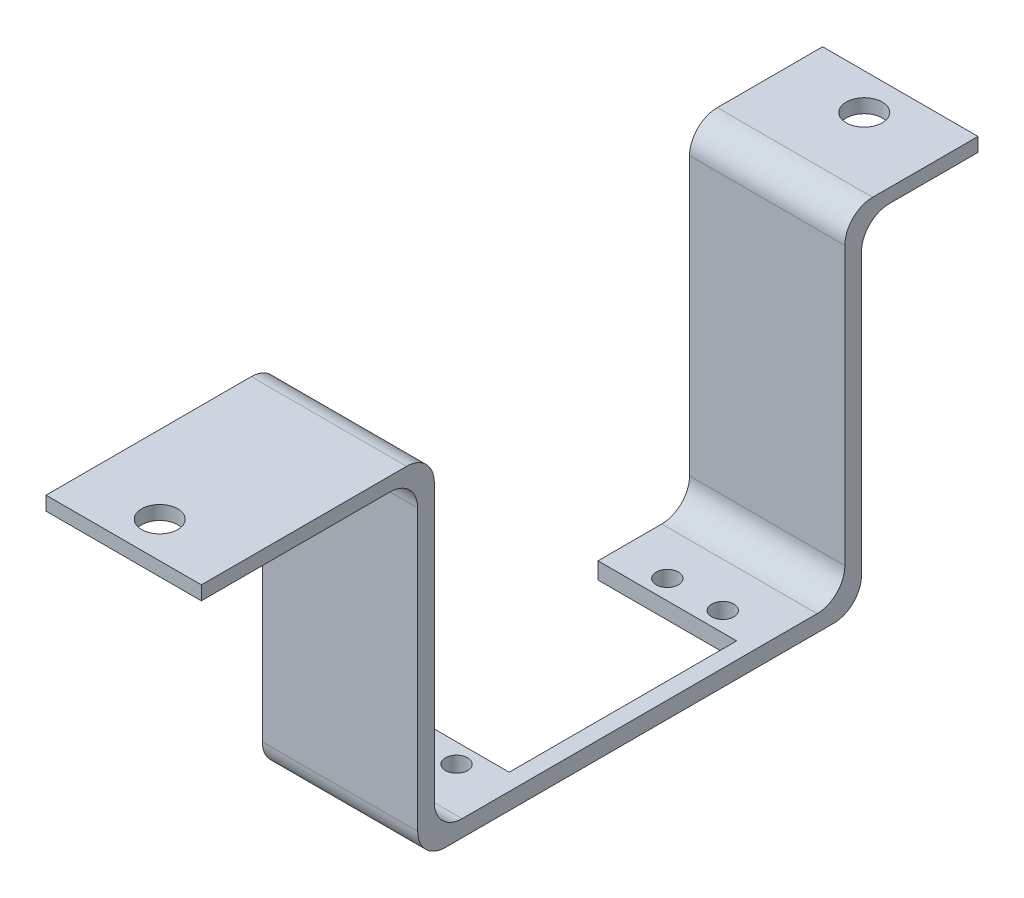
from build123d import *

# Parameters (mm, degrees)
SKETCH1_W               = 32
SKETCH1_H               = 80
BOSS_EXTRUDE1_DEPTH     = 3
SKETCH4_W               = 32
SKETCH4_H               = 80
SKETCH4_W_2             = 27
SKETCH4_H_2             = 74
BOSS_EXTRUDE2_DEPTH     = 57.5
SKETCH5_W               = 32
SKETCH5_H               = 140
BOSS_EXTRUDE3_DEPTH     = 2.5
CUT_EXTRUDE1_DEPTH      = 50.8
CUT_EXTRUDE1_DEPTH_BACK = 94.573500522
SKETCH2_W               = 22
SKETCH2_H               = 41
SKETCH6_R               = 3.25
SKETCH6_W               = 22
SKETCH6_H               = 74
CUT_EXTRUDE2_DEPTH      = 25.4
CUT_EXTRUDE3_DEPTH      = 100.463561167
CUT_EXTRUDE3_DEPTH_BACK = 100.463561167
SKETCH8_W               = 74
SKETCH8_H               = 60
SKETCH7_R               = 2
CUT_EXTRUDE4_DEPTH      = 94.573500522
SKETCH10_W              = 2
SKETCH10_H              = 140
CUT_EXTRUDE5_DEPTH      = 96.524865873
FILLET1_R               = 5
SKETCH13_W              = 3
SKETCH13_H              = 41
CUT_EXTRUDE7_DEPTH      = 94.252345815


with BuildPart() as part:
    # Sketch1 → Boss-Extrude1 (new body)
    with BuildSketch(Plane(origin=(0, 0, 0), x_dir=(1, 0, 0), z_dir=(0, 1, 0))):
        with Locations((0, 9)):
            Rectangle(SKETCH1_W, SKETCH1_H)
    extrude(amount=BOSS_EXTRUDE1_DEPTH)

    # Sketch4 → Boss-Extrude2 (add)
    with BuildSketch(Plane(origin=(0, 3, 0), x_dir=(1, 0, 0), z_dir=(0, 1, 0))):
        with Locations((0, 9)):
            Rectangle(SKETCH4_W, SKETCH4_H)
        with Locations((0, 9)):
            Rectangle(SKETCH4_W_2, SKETCH4_H_2, mode=Mode.SUBTRACT)
    extrude(amount=BOSS_EXTRUDE2_DEPTH)

    # Sketch5 → Boss-Extrude3 (add)
    with BuildSketch(Plane(origin=(0, 60.5, 0), x_dir=(1, 0, 0), z_dir=(0, 1, 0))):
        Rectangle(SKETCH5_W, SKETCH5_H)
    extrude(amount=BOSS_EXTRUDE3_DEPTH)

    # Sketch2 → Cut-Extrude1 (cut, two sides: drawn at the far end of the back side and taken through both)
    with BuildSketch(Plane(origin=(0, 3, 0), x_dir=(1, 0, 0), z_dir=(0, 1, 0)).offset(-CUT_EXTRUDE1_DEPTH_BACK)):
        with Locations((0, 9)):
            Rectangle(SKETCH2_W, SKETCH2_H)
    extrude(amount=CUT_EXTRUDE1_DEPTH + CUT_EXTRUDE1_DEPTH_BACK, mode=Mode.SUBTRACT)

    # Sketch6 → Cut-Extrude2 (cut)
    with BuildSketch(Plane(origin=(0, 63, 0), x_dir=(1, 0, 0), z_dir=(0, 1, 0))):
        with Locations(Location((0, 63.5, 0), (0, 0, 270))):
            Circle(SKETCH6_R)
        with Locations(Location((0, -63.5, 0), (0, 0, 270))):
            Circle(SKETCH6_R)
        with Locations((0, 9)):
            Rectangle(SKETCH6_W, SKETCH6_H)
    extrude(amount=-CUT_EXTRUDE2_DEPTH, mode=Mode.SUBTRACT)

    # Sketch8 → Cut-Extrude3 (cut, two sides: drawn at the far end of the back side and taken through both)
    with BuildSketch(Plane(origin=(16, 0, 0), x_dir=(0, 0, -1), z_dir=(1, 0, 0)).offset(-CUT_EXTRUDE3_DEPTH_BACK)):
        with Locations((9, 33)):
            Rectangle(SKETCH8_W, SKETCH8_H)
    extrude(amount=CUT_EXTRUDE3_DEPTH + CUT_EXTRUDE3_DEPTH_BACK, mode=Mode.SUBTRACT)

    # Sketch7 → Cut-Extrude4 (cut, through all)
    with BuildSketch(Plane(origin=(0, 3, 0), x_dir=(1, 0, 0), z_dir=(0, 1, 0))):
        with Locations(Location((-5, 33, 0), (0, 0, 270))):
            Circle(SKETCH7_R)
        with Locations(Location((5, 33, 0), (0, 0, 270))):
            Circle(SKETCH7_R)
        with Locations(Location((-5, -15, 0), (0, 0, 270))):
            Circle(SKETCH7_R)
        with Locations(Location((5, -15, 0), (0, 0, 270))):
            Circle(SKETCH7_R)
    extrude(amount=-CUT_EXTRUDE4_DEPTH, mode=Mode.SUBTRACT)

    # Sketch10 → Cut-Extrude5 (cut, through all)
    with BuildSketch(Plane(origin=(0, 63, 0), x_dir=(1, 0, 0), z_dir=(0, 1, 0))):
        with Locations((-15, 0)):
            Rectangle(SKETCH10_W, SKETCH10_H)
        with Locations((15, 0)):
            Rectangle(SKETCH10_W, SKETCH10_H)
    extrude(amount=-CUT_EXTRUDE5_DEPTH, mode=Mode.SUBTRACT)

    # Fillet1
    fillet1_edges = [part.edges().sort_by_distance(p)[0] for p in [
        (0, 63, -46),
        (0, 60.5, 31),
        (0, 60.5, -49),
        (0, 0, -49),
        (0, 0, 31),
        (0, 3, 28),
        (0, 63, 28),
        (0, 3, -46),
    ]]
    fillet(fillet1_edges, radius=FILLET1_R)

    # Sketch13 → Cut-Extrude7 (cut, through all)
    with BuildSketch(Plane(origin=(0, 3, 0), x_dir=(1, 0, 0), z_dir=(0, 1, 0))):
        with Locations((-12.5, 9)):
            Rectangle(SKETCH13_W, SKETCH13_H)
    extrude(amount=-CUT_EXTRUDE7_DEPTH, mode=Mode.SUBTRACT)


solid = part.part
